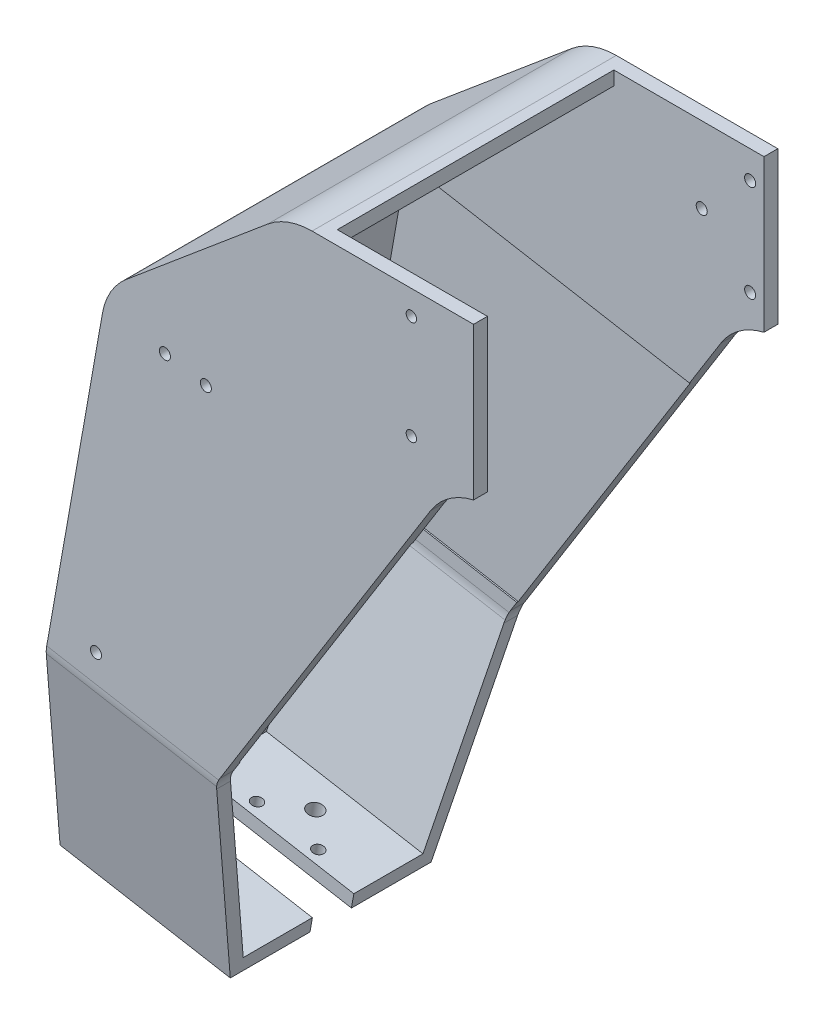
from build123d import *

# Parameters (mm, degrees)
EXTRUDE_1_DEPTH      = 20
CUT_EXTRUDE_1_DEPTH  = 2
EXTRUDE_START        = 2
EXTRUDE_2_DEPTH      = 2
EXTRUDE_3_DEPTH      = 33
CUT_EXTRUDE_10_DEPTH = 22.5
EXTRUDE_4_DEPTH      = 25
SKETCH_19_W          = 6
SKETCH_19_H          = 22
CUT_EXTRUDE_11_DEPTH = 84.590810023
CUT_EXTRUDE_7_REACH  = 84.162
SKETCH_15_R          = 0.75
CUT_EXTRUDE_8_REACH  = 84.162
SKETCH_16_R          = 0.8
CUT_EXTRUDE_9_REACH  = 117.914
SKETCH_17_W          = 21.713584054
SKETCH_17_H          = 40
CUT_EXTRUDE_13_REACH = 84.162
SKETCH_23_R          = 0.8
SKETCH_24_R          = 0.8
CUT_EXTRUDE_14_DEPTH = 83.162435205
SKETCH_25_W          = 4
SKETCH_25_H          = 20
CUT_EXTRUDE_15_DEPTH = 82.996087258
CUT_EXTRUDE_16_REACH = 121.797
SKETCH_26_R          = 0.8
CUT_EXTRUDE_17_REACH = 121.797
SKETCH_27_R          = 1.1
FILLET_1_R           = 5
FILLET_2_R           = 5
FILLET_3_R           = 5
CUT_EXTRUDE_18_DEPTH = 20.2


with BuildPart() as part:
    # 草图1 → 凸台-拉伸1 (new, symmetric)
    with BuildSketch(Plane.XY):
        with BuildLine():
            Line((20.657346874, 53.638724152), (44.017644532, 53.638724152))
            Line((44.017644532, 53.638724152), (44.017644532, 51.638724152))
            Line((44.017644532, 51.638724152), (21.385287343, 51.638724152))
            ThreePointArc((21.385287343, 51.638724152), (17.96508591, 51.03565036), (14.957411246, 49.299168583))
            Line((14.957411246, 49.299168583), (-4.39648281, 33.059323219))
            ThreePointArc((-4.39648281, 33.059323219), (-6.628860751, 30.398878788), (-7.816684243, 27.135360565))
            Line((-7.816684243, 27.135360565), (-20.950105242, -47.347971173))
            Line((-20.950105242, -47.347971173), (-22.919720748, -47.000674818))
            Line((-22.919720748, -47.000674818), (-9.659894213, 28.199538337))
            ThreePointArc((-9.659894213, 28.199538337), (-8.472070721, 31.463056561), (-6.23969278, 34.123500992))
            Line((-6.23969278, 34.123500992), (14.229470778, 51.299168583))
            ThreePointArc((14.229470778, 51.299168583), (17.237145441, 53.03565036), (20.657346874, 53.638724152))
        make_face()
    extrude(amount=EXTRUDE_1_DEPTH, both=True)

    # 草图3 → 切除-拉伸1 (cut)
    with BuildSketch(Plane(origin=(-14.191017833, 2.502259328, 0), x_dir=(0, 0, 1), z_dir=(-0.9848077530122074, 0.17364817766693458, 0))):
        Polygon((13, -50.266596698), (20, -50.266596698), (20, -20.906299041), align=None)
    cut_extrude_1 = extrude(amount=-CUT_EXTRUDE_1_DEPTH, mode=Mode.SUBTRACT)

    # 镜向1: 切除-拉伸1 across plane
    add(cut_extrude_1.mirror(Plane.XY), mode=Mode.SUBTRACT)

    # 草图4 → 凸台-拉伸2 (add)
    with BuildSketch(Plane.XY.offset(20).offset(EXTRUDE_START)):
        with BuildLine():
            Line((44.017644532, 53.638724152), (44.017644532, 31.638724152))
            ThreePointArc((44.017644532, 31.638724152), (40.473292143, 30.034681338), (37.809285693, 27.199464091))
            Line((37.809285693, 27.199464091), (6.798835262, -22.427630496))
            Line((6.798835262, -22.427630496), (-17.821358564, -18.086426054))
            Line((-17.821358564, -18.086426054), (-9.659894213, 28.199538337))
            ThreePointArc((-9.659894213, 28.199538337), (-8.472070721, 31.463056561), (-6.23969278, 34.123500992))
            Line((-6.23969278, 34.123500992), (14.229470778, 51.299168583))
            ThreePointArc((14.229470778, 51.299168583), (17.237145441, 53.03565036), (20.657346874, 53.638724152))
            Line((20.657346874, 53.638724152), (44.017644532, 53.638724152))
        make_face()
    extrude_2 = extrude(amount=-EXTRUDE_2_DEPTH)

    # 草图5 → 凸台-拉伸3 (add)
    with BuildSketch(Plane(origin=(-14.191017833, 2.502259328, 0), x_dir=(0, 0, 1), z_dir=(-0.9848077530122074, 0.17364817766693458, 0))):
        Polygon((22, -20.906299041), (15, -50.266596698), (13, -50.266596698), (20, -20.906299041), align=None)
    extrude_3 = extrude(amount=-EXTRUDE_3_DEPTH)

    # 镜向3: 凸台-拉伸2, 凸台-拉伸3 across plane
    add(extrude_2.mirror(Plane.XY))
    add(extrude_3.mirror(Plane.XY))

    # 草图18 → 切除-拉伸10 (cut, symmetric)
    with BuildSketch(Plane.XY):
        Polygon((6.798835262, -22.427630496), (1.700473078, -51.34187926), (9.578935102, -52.731064681), (14.677297286, -23.816815917), align=None)
    extrude(amount=CUT_EXTRUDE_10_DEPTH, both=True, mode=Mode.SUBTRACT)

    # 草图10 → 凸台-拉伸4 (add)
    with BuildSketch(Plane(origin=(-14.191017833, 2.502259328, 0), x_dir=(0, 0, 1), z_dir=(-0.9848077530122074, 0.17364817766693458, 0))):
        Polygon((-15, -50.266596698), (15, -50.266596698), (14.523165597, -52.266596698), (-14.523165597, -52.266596698), align=None)
    extrude(amount=-EXTRUDE_4_DEPTH)

    # 草图19 → 切除-拉伸11 (cut, through all)
    with BuildSketch(Plane(origin=(-14.191017833, 2.502259328, 0), x_dir=(0, 0, 1), z_dir=(-0.9848077530122074, 0.17364817766693458, 0))):
        with Locations((0, -41.266596698)):
            Rectangle(SKETCH_19_W, SKETCH_19_H)
    extrude(amount=-CUT_EXTRUDE_11_DEPTH, mode=Mode.SUBTRACT)

    # 草图15 → 切除-拉伸7 (cut, up to next)
    with BuildSketch(Plane.XY.offset(22), mode=Mode.PRIVATE) as cut_extrude_7_sk1:
        with Locations((35.017644532, 50.138724152)):
            Circle(SKETCH_15_R)
    cut_extrude_7_tool1 = extrude(cut_extrude_7_sk1.sketch, amount=-CUT_EXTRUDE_7_REACH, mode=Mode.PRIVATE) & part.part
    # 草图15 → 切除-拉伸7 (cut, up to next)
    with BuildSketch(Plane.XY.offset(22), mode=Mode.PRIVATE) as cut_extrude_7_sk2:
        with Locations((35.017644532, 35.138724152)):
            Circle(SKETCH_15_R)
    cut_extrude_7_tool2 = extrude(cut_extrude_7_sk2.sketch, amount=-CUT_EXTRUDE_7_REACH, mode=Mode.PRIVATE) & part.part
    add(cut_extrude_7_tool1.solids().sort_by_distance((35.017645, 50.138724, 22))[0], mode=Mode.SUBTRACT)
    add(cut_extrude_7_tool2.solids().sort_by_distance((35.017645, 35.138724, 22))[0], mode=Mode.SUBTRACT)

    # 草图16 → 切除-拉伸8 (cut, up to next)
    with BuildSketch(Plane(origin=(0, 0, -22), x_dir=(-1, 0, 0), z_dir=(0, 0, -1)), mode=Mode.PRIVATE) as cut_extrude_8_sk1:
        with Locations((-42.017644532, 49.638724152)):
            Circle(SKETCH_16_R)
    cut_extrude_8_tool1 = extrude(cut_extrude_8_sk1.sketch, amount=-CUT_EXTRUDE_8_REACH, mode=Mode.PRIVATE) & part.part
    # 草图16 → 切除-拉伸8 (cut, up to next)
    with BuildSketch(Plane(origin=(0, 0, -22), x_dir=(-1, 0, 0), z_dir=(0, 0, -1)), mode=Mode.PRIVATE) as cut_extrude_8_sk2:
        with Locations((-42.017644532, 35.638724152)):
            Circle(SKETCH_16_R)
    cut_extrude_8_tool2 = extrude(cut_extrude_8_sk2.sketch, amount=-CUT_EXTRUDE_8_REACH, mode=Mode.PRIVATE) & part.part
    # 草图16 → 切除-拉伸8 (cut, up to next)
    with BuildSketch(Plane(origin=(0, 0, -22), x_dir=(-1, 0, 0), z_dir=(0, 0, -1)), mode=Mode.PRIVATE) as cut_extrude_8_sk3:
        with Locations((-35.017644532, 42.638724152)):
            Circle(SKETCH_16_R)
    cut_extrude_8_tool3 = extrude(cut_extrude_8_sk3.sketch, amount=-CUT_EXTRUDE_8_REACH, mode=Mode.PRIVATE) & part.part
    add(cut_extrude_8_tool1.solids().sort_by_distance((42.017645, 49.638724, -22))[0], mode=Mode.SUBTRACT)
    add(cut_extrude_8_tool2.solids().sort_by_distance((42.017645, 35.638724, -22))[0], mode=Mode.SUBTRACT)
    add(cut_extrude_8_tool3.solids().sort_by_distance((35.017645, 42.638724, -22))[0], mode=Mode.SUBTRACT)

    # 草图17 → 切除-拉伸9 (cut, up to next)
    with BuildSketch(Plane.XZ.offset(-51.638724152), mode=Mode.PRIVATE) as cut_extrude_9_sk1:
        with Locations((33.160852505, 0)):
            Rectangle(SKETCH_17_W, SKETCH_17_H)
    cut_extrude_9_tool1 = extrude(cut_extrude_9_sk1.sketch, amount=-CUT_EXTRUDE_9_REACH, mode=Mode.PRIVATE) & part.part
    add(cut_extrude_9_tool1.solids().sort_by_distance((33.160853, 51.638724, 0))[0], mode=Mode.SUBTRACT)

    # 草图23 → 切除-拉伸13 (cut, up to next)
    with BuildSketch(Plane.XY.offset(22), mode=Mode.PRIVATE) as cut_extrude_13_sk1:
        with Locations((-0.619145661, 27.643236889)):
            Circle(SKETCH_23_R)
    cut_extrude_13_tool1 = extrude(cut_extrude_13_sk1.sketch, amount=-CUT_EXTRUDE_13_REACH, mode=Mode.PRIVATE) & part.part
    # 草图23 → 切除-拉伸13 (cut, up to next)
    with BuildSketch(Plane.XY.offset(22), mode=Mode.PRIVATE) as cut_extrude_13_sk2:
        with Locations((5.289700857, 26.601347823)):
            Circle(SKETCH_23_R)
    cut_extrude_13_tool2 = extrude(cut_extrude_13_sk2.sketch, amount=-CUT_EXTRUDE_13_REACH, mode=Mode.PRIVATE) & part.part
    add(cut_extrude_13_tool1.solids().sort_by_distance((-0.619146, 27.643237, 22))[0], mode=Mode.SUBTRACT)
    add(cut_extrude_13_tool2.solids().sort_by_distance((5.289701, 26.601348, 22))[0], mode=Mode.SUBTRACT)

    # 草图24 → 切除-拉伸14 (cut, through all)
    with BuildSketch(Plane.XY.offset(22)):
        with Locations((-10.595826096, -14.770754093)):
            Circle(SKETCH_24_R)
    extrude(amount=-CUT_EXTRUDE_14_DEPTH, mode=Mode.SUBTRACT)

    # 草图25 → 切除-拉伸15 (cut, through all)
    with BuildSketch(Plane(origin=(-12.221402327, 2.154962972, 0), x_dir=(0, 0, -1), z_dir=(0.9848077530122075, -0.1736481776669347, 0))):
        with Locations((5, -40.266596698)):
            Rectangle(SKETCH_25_W, SKETCH_25_H)
    extrude(amount=-CUT_EXTRUDE_15_DEPTH, mode=Mode.SUBTRACT)

    # 草图26 → 切除-拉伸16 (cut, up to next)
    with BuildSketch(Plane(origin=(-9.075999269, -51.472549652, 0), x_dir=(0.9848077530122074, -0.17364817766693458, 0), z_dir=(-0.17364817766693458, -0.9848077530122074, 0)), mode=Mode.PRIVATE) as cut_extrude_16_sk1:
        with Locations((3.590062842, -4.75)):
            Circle(SKETCH_26_R)
    cut_extrude_16_tool1 = extrude(cut_extrude_16_sk1.sketch, amount=-CUT_EXTRUDE_16_REACH, mode=Mode.PRIVATE) & part.part
    # 草图26 → 切除-拉伸16 (cut, up to next)
    with BuildSketch(Plane(origin=(-9.075999269, -51.472549652, 0), x_dir=(0.9848077530122074, -0.17364817766693458, 0), z_dir=(-0.17364817766693458, -0.9848077530122074, 0)), mode=Mode.PRIVATE) as cut_extrude_16_sk2:
        with Locations((-5.409937158, -4.75)):
            Circle(SKETCH_26_R)
    cut_extrude_16_tool2 = extrude(cut_extrude_16_sk2.sketch, amount=-CUT_EXTRUDE_16_REACH, mode=Mode.PRIVATE) & part.part
    add(cut_extrude_16_tool1.solids().sort_by_distance((-5.540478, -52.095958, -4.75))[0], mode=Mode.SUBTRACT)
    add(cut_extrude_16_tool2.solids().sort_by_distance((-14.403747, -50.533124, -4.75))[0], mode=Mode.SUBTRACT)

    # 草图27 → 切除-拉伸17 (cut, up to next)
    with BuildSketch(Plane(origin=(-9.075999269, -51.472549652, 0), x_dir=(0.9848077530122074, -0.17364817766693458, 0), z_dir=(-0.17364817766693458, -0.9848077530122074, 0)), mode=Mode.PRIVATE) as cut_extrude_17_sk1:
        with Locations((-0.909937158, -8.75)):
            Circle(SKETCH_27_R)
    cut_extrude_17_tool1 = extrude(cut_extrude_17_sk1.sketch, amount=-CUT_EXTRUDE_17_REACH, mode=Mode.PRIVATE) & part.part
    add(cut_extrude_17_tool1.solids().sort_by_distance((-9.972112, -51.314541, -8.75))[0], mode=Mode.SUBTRACT)

    # 圆角1
    fillet_1_edges = [part.edges().sort_by_distance(p)[0] for p in [
        (-5.511261651, -20.257028275, -22),
        (-5.511261651, -20.257028275, 22),
    ]]
    fillet(fillet_1_edges, radius=FILLET_1_R)

    # 圆角2
    fillet_2_edges = [part.edges().sort_by_distance(p)[0] for p in [
        (-4.526453898, -20.430676453, -20),
        (-4.526453898, -20.430676453, 20),
    ]]
    fillet(fillet_2_edges, radius=FILLET_2_R)

    # 圆角3
    fillet_3_edges = [part.edges().sort_by_distance(p)[0] for p in [
        (6.798835262, -22.427630496, 20.965328277),
        (6.798835262, -22.427630496, -20.965328277),
    ]]
    fillet(fillet_3_edges, radius=FILLET_3_R)

    # 草图28 → 切除-拉伸18 (cut, symmetric)
    with BuildSketch(Plane.XY):
        Polygon((-15.402375378, -15.885231658), (-7.816684243, 27.135360565), (37.188945048, 19.199653837), (27.398461996, -23.432174084), align=None)
    extrude(amount=CUT_EXTRUDE_18_DEPTH, both=True, mode=Mode.SUBTRACT)


solid = part.part
